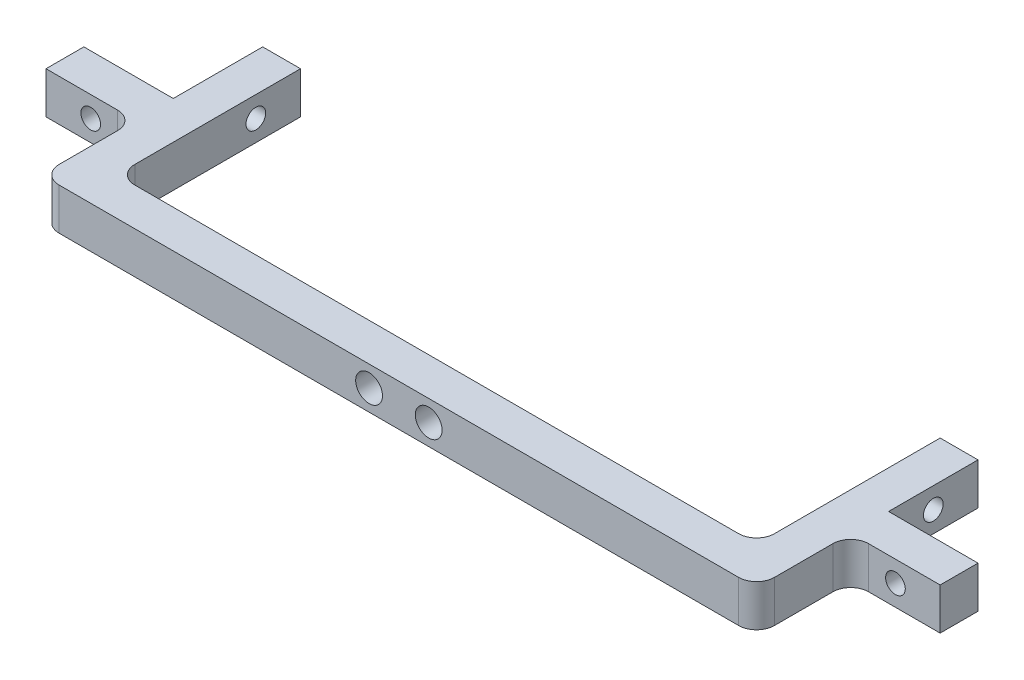
from build123d import *

# Parameters (mm, degrees)
BOSS_EXTRUDE1_DEPTH = 7
SKETCH2_R           = 1.65
CUT_EXTRUDE1_DEPTH  = 139.646530772
SKETCH3_R           = 1.65
CUT_EXTRUDE2_DEPTH  = 6.35
FILLET1_R           = 3
SKETCH4_R           = 2.25
CUT_EXTRUDE3_DEPTH  = 6.35


with BuildPart() as part:
    # Sketch1 → Boss-Extrude1 (new body)
    with BuildSketch(Plane(origin=(0, 0, 0), x_dir=(1, 0, 0), z_dir=(0, 1, 0))):
        Polygon((0, 0), (53.650408323, 0), (53.650408323, 30.8), (60.000408323, 30.8), (60.000408323, 15.8), (75.000408323, 15.8), (75.000408323, 9.45), (60.000408323, 9.45), (60.000408323, -6.35), (-59.999591677, -6.35), (-60.000408323, 9.45), (-75.000408323, 9.45), (-75.000408323, 15.8), (-60.000408323, 15.8), (-60.000408323, 30.8), (-53.650408323, 30.8), (-53.650408323, 0), align=None)
    extrude(amount=BOSS_EXTRUDE1_DEPTH)

    # Sketch2 → Cut-Extrude1 (cut, through all)
    with BuildSketch(Plane(origin=(60.000408323, 0, 0), x_dir=(0, 0, -1), z_dir=(1, 0, 0))):
        with Locations((23.3, 3.5)):
            Circle(SKETCH2_R)
    extrude(amount=-CUT_EXTRUDE1_DEPTH, mode=Mode.SUBTRACT)

    # Sketch3 → Cut-Extrude2 (cut)
    with BuildSketch(Plane(origin=(0, 0, -15.8), x_dir=(-1, 0, 0), z_dir=(0, 0, -1))):
        with Locations((-67.500408323, 3.5)):
            Circle(SKETCH3_R)
        with Locations((67.500408323, 3.5)):
            Circle(SKETCH3_R)
    extrude(amount=-CUT_EXTRUDE2_DEPTH, mode=Mode.SUBTRACT)

    # Fillet1
    fillet1_edges = [part.edges().sort_by_distance(p)[0] for p in [
        (53.650408323, 3.5, 0),
        (60.000408323, 3.5, -9.45),
        (60.000408323, 3.5, 6.35),
        (-59.999591677, 3.5, 6.35),
        (-60.000408323, 3.5, -9.45),
        (-53.650408323, 3.5, 0),
    ]]
    fillet(fillet1_edges, radius=FILLET1_R)

    # Sketch4 → Cut-Extrude3 (cut)
    with BuildSketch(Plane.XY.offset(6.35)):
        with Locations((5.000165403, 3.5)):
            Circle(SKETCH4_R)
        with Locations((-4.999834586, 3.500472565)):
            Circle(SKETCH4_R)
    extrude(amount=-CUT_EXTRUDE3_DEPTH, mode=Mode.SUBTRACT)


solid = part.part
